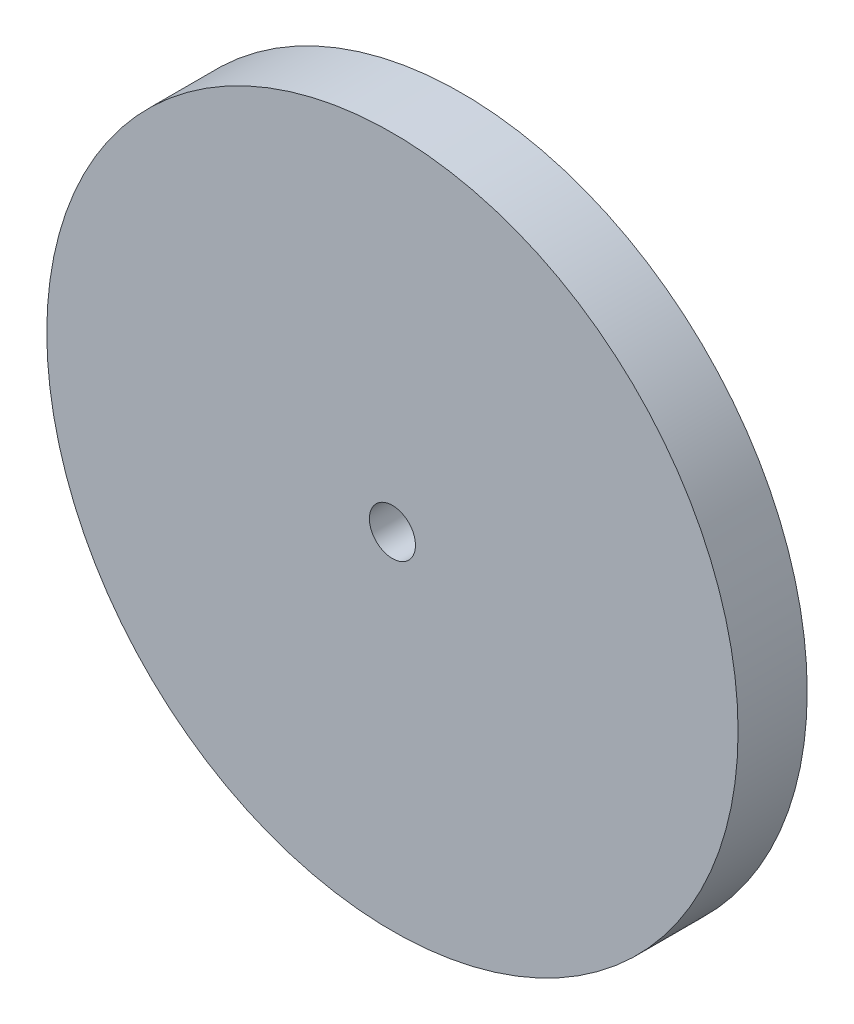
from build123d import *

# Parameters (mm, degrees)
SKETCH1_R           = 762
SKETCH1_R_2         = 50.8
BOSS_EXTRUDE1_DEPTH = 152.4


with BuildPart() as part:
    # Sketch1 → Boss-Extrude1 (new body)
    with BuildSketch(Plane.XY):
        with Locations(Location((0, 0, 0), (0, 0, 180))):
            Circle(SKETCH1_R)
        with Locations(Location((0, 0, 0), (0, 0, 180))):
            Circle(SKETCH1_R_2, mode=Mode.SUBTRACT)
    extrude(amount=BOSS_EXTRUDE1_DEPTH)


solid = part.part
